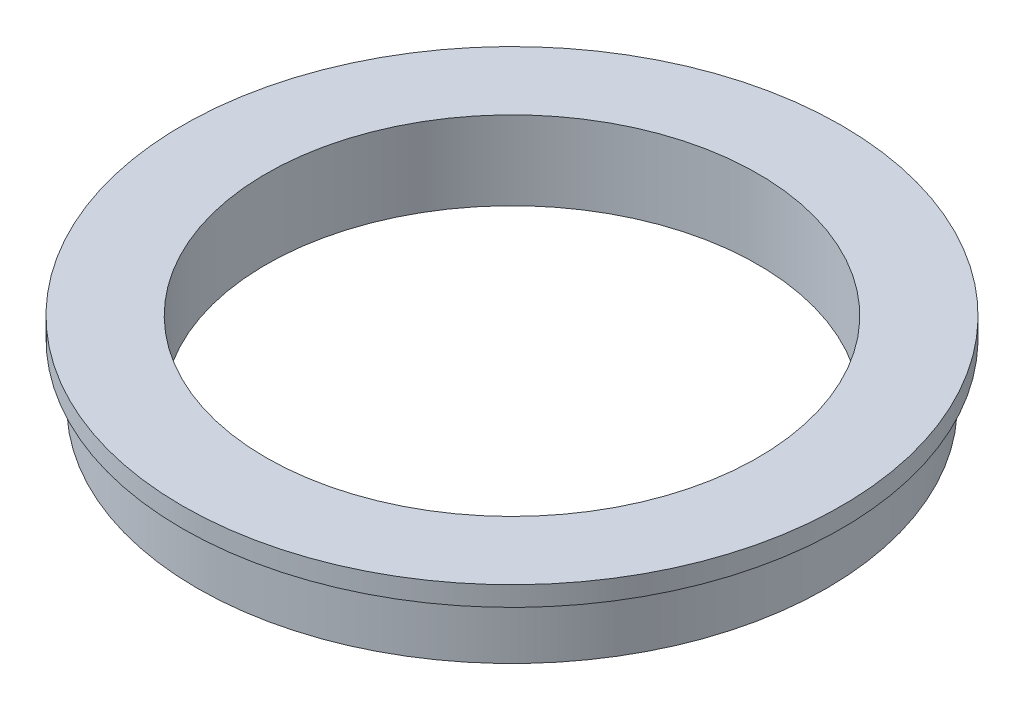
from build123d import *

# Parameters (mm, degrees)
SKETCH_1_R      = 16
SKETCH_1_R_2    = 12.5
EXTRUDE_1_DEPTH = 4
EXTRUDE_START   = -1
SKETCH_2_R      = 16.75
SKETCH_2_R_2    = 16
EXTRUDE_2_DEPTH = 1


with BuildPart() as part:
    # 草图1 → 凸台-拉伸1 (new body)
    with BuildSketch(Plane(origin=(0, 0, 0), x_dir=(1, 0, 0), z_dir=(0, 1, 0))):
        with Locations(Location((0, 0, 0), (0, 0, 270))):
            Circle(SKETCH_1_R)
        with Locations(Location((0, 0, 0), (0, 0, 270))):
            Circle(SKETCH_1_R_2, mode=Mode.SUBTRACT)
    extrude(amount=EXTRUDE_1_DEPTH)

    # 草图2 → 凸台-拉伸2 (add)
    with BuildSketch(Plane(origin=(0, 4, 0), x_dir=(1, 0, 0), z_dir=(0, 1, 0)).offset(EXTRUDE_START)):
        with Locations(Location((0, 0, 0), (0, 0, 270))):
            Circle(SKETCH_2_R)
        with Locations(Location((0, 0, 0), (0, 0, 270))):
            Circle(SKETCH_2_R_2, mode=Mode.SUBTRACT)
    extrude(amount=EXTRUDE_2_DEPTH)


solid = part.part
